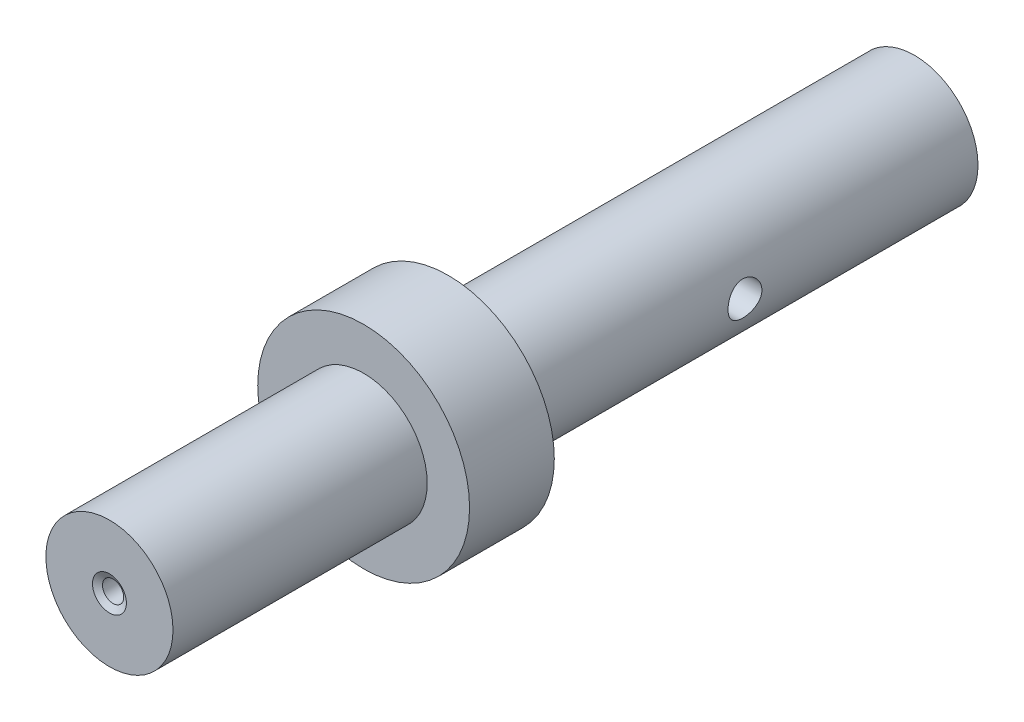
from build123d import *

# Parameters (mm, degrees)
SKETCH1_R                       = 12.5
F_25MM_DIA_DEPTH                = 10
F_15MM_START                    = -10
SKETCH2_R                       = 7.5
F_15MM_DIA_BEARING_END_DEPTH    = 40
F_15MM_START_2                  = 55
SKETCH3_R                       = 7.5
F_15MM_DIA_GEAR_END_DEPTH       = 55
M3X0_5_TAPPED_HOLE1_D           = 2.5
M3X0_5_TAPPED_HOLE1_DEPTH       = 15
M3X0_5_TAPPED_HOLE1_CSINK_D     = 4
M3X0_5_TAPPED_HOLE1_CSINK_ANGLE = 120
M3X0_5_TAPPED_HOLE1_TIP         = 0.751075774
SKETCH7_R                       = 2
CUT_EXTRUDE1_DEPTH              = 60.843546018


with BuildPart() as part:
    # Sketch1 → 25mm dia (new body)
    with BuildSketch(Plane.XY):
        Circle(SKETCH1_R)
    extrude(amount=F_25MM_DIA_DEPTH)

    # Sketch2 → 15mm dia bearing end (add)
    with BuildSketch(Plane.XY.offset(10).offset(F_15MM_START)):
        Circle(SKETCH2_R)
    extrude(amount=F_15MM_DIA_BEARING_END_DEPTH)

    # Sketch3 → 15mm dia gear end (add)
    with BuildSketch(Plane(origin=(0, 0, 0), x_dir=(-1, 0, 0), z_dir=(0, 0, -1)).offset(F_15MM_START_2)):
        with Locations(Location((0, 0, 0), (0, 0, 180))):
            Circle(SKETCH3_R)
    extrude(amount=-F_15MM_DIA_GEAR_END_DEPTH)

    # M3x0.5 Tapped Hole1
    with Locations(Plane.XY.offset(40)):
        with Locations((0, 0)):
            CounterSinkHole(M3X0_5_TAPPED_HOLE1_D / 2, M3X0_5_TAPPED_HOLE1_CSINK_D / 2, depth=M3X0_5_TAPPED_HOLE1_DEPTH, counter_sink_angle=M3X0_5_TAPPED_HOLE1_CSINK_ANGLE)
            with Locations((0, 0, -(M3X0_5_TAPPED_HOLE1_DEPTH + M3X0_5_TAPPED_HOLE1_TIP / 2))):  # 118° drill point
                Cone(0, M3X0_5_TAPPED_HOLE1_D / 2, M3X0_5_TAPPED_HOLE1_TIP, mode=Mode.SUBTRACT)

    # Sketch7 → Cut-Extrude1 (cut, through all)
    with BuildSketch(Plane(origin=(7.5, 0, 0), x_dir=(0, 0, -1), z_dir=(1, 0, 0))):
        with Locations((27.5, 0)):
            Circle(SKETCH7_R)
    extrude(amount=-CUT_EXTRUDE1_DEPTH, mode=Mode.SUBTRACT)


solid = part.part
